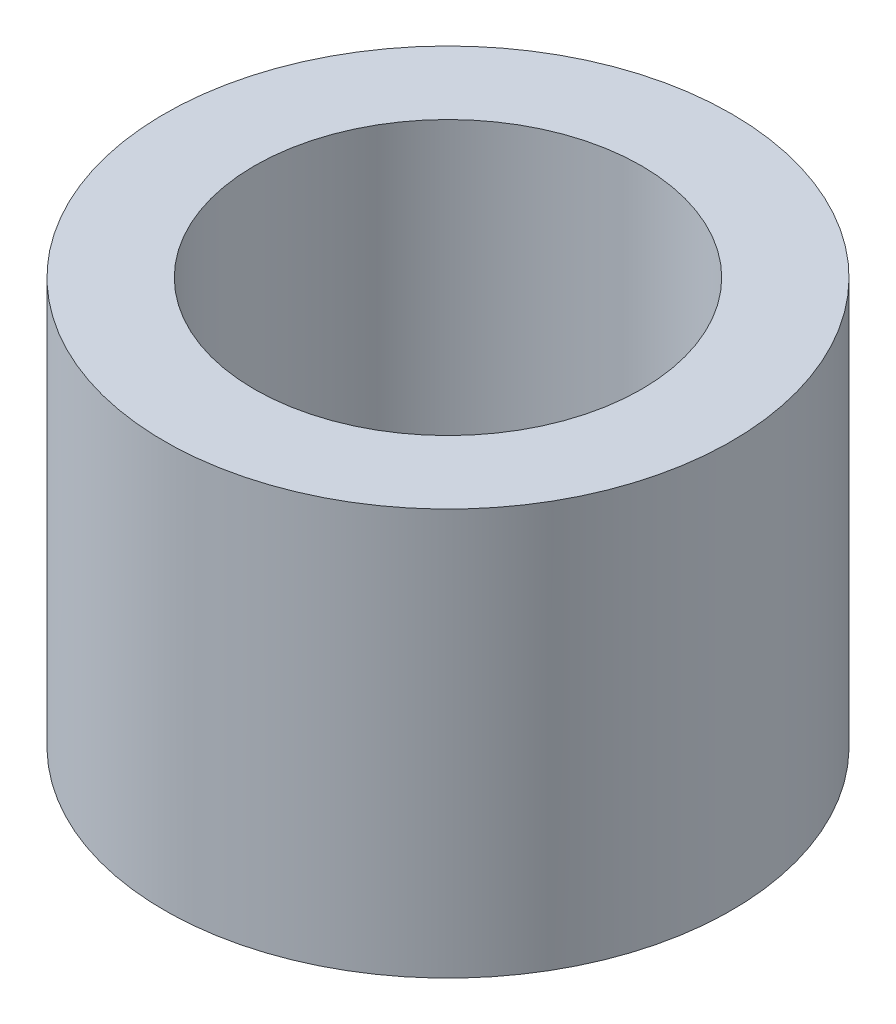
from build123d import *

# Parameters (mm, degrees)
SKETCH1_R           = 8.001
SKETCH1_R_2         = 5.461
BOSS_EXTRUDE1_DEPTH = 11.461
CUT_EXTRUDE1_START  = 11.461
SKETCH1_6_R         = 5.461
CUT_EXTRUDE1_DEPTH  = 9.46


with BuildPart() as part:
    # Sketch1 → Boss-Extrude1 (new body)
    # profile 1 of 2: a face of its own
    with BuildSketch(Plane(origin=(0, 0, 0), x_dir=(1, 0, 0), z_dir=(0, 1, 0))):
        with Locations(Location((0, 0, 0), (0, 0, 90))):
            Circle(SKETCH1_R)
        Circle(SKETCH1_R_2, mode=Mode.SUBTRACT)
    # profile 2 of 2: a face of its own
    with BuildSketch(Plane(origin=(0, 0, 0), x_dir=(1, 0, 0), z_dir=(0, 1, 0))):
        Circle(SKETCH1_R_2)
    extrude(amount=BOSS_EXTRUDE1_DEPTH)

    # Sketch2 → Revolve1 (revolve)
    with BuildSketch(Plane.XY, mode=Mode.PRIVATE) as revolve1_sk:
        Polygon((0, 0), (0, -2.54), (8.001, 0), align=None)
    revolve(revolve1_sk.sketch.rotate(Axis((0, 0, 0), (0, -1, 0)), 180), axis=Axis((0, 0, 0), (0, -1, 0)))

    # Sketch1<6> → Cut-Extrude1 (cut)
    with BuildSketch(Plane(origin=(0, 0, 0), x_dir=(1, 0, 0), z_dir=(0, 1, 0)).offset(CUT_EXTRUDE1_START)):
        with Locations(Location((0, 0, 0), (0, 0, 270))):
            Circle(SKETCH1_6_R)
    extrude(amount=-CUT_EXTRUDE1_DEPTH, mode=Mode.SUBTRACT)


solid = part.part
